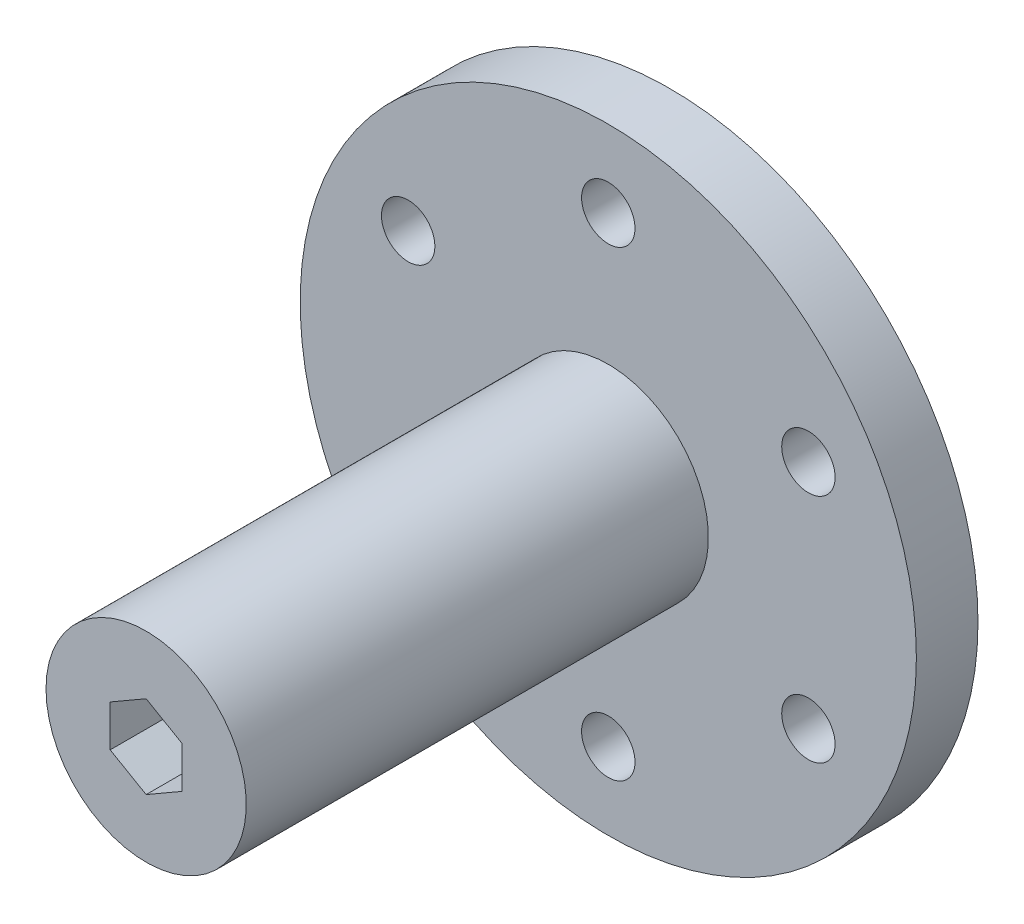
from build123d import *

# Parameters (mm, degrees)
SKETCH1_R           = 30
BOSS_EXTRUDE1_DEPTH = 6
SKETCH2_R           = 9.75
BOSS_EXTRUDE2_DEPTH = 45
CUT_EXTRUDE1_DEPTH  = 67.340033162
SKETCH5_R           = 2.6
CUT_EXTRUDE3_DEPTH  = 30


with BuildPart() as part:
    # Sketch1 → Boss-Extrude1 (new body)
    with BuildSketch(Plane.XY):
        Circle(SKETCH1_R)
    extrude(amount=BOSS_EXTRUDE1_DEPTH)

    # Sketch2 → Boss-Extrude2 (add)
    with BuildSketch(Plane.XY.offset(6)):
        with Locations(Location((0, 0, 0), (0, 0, 180))):
            Circle(SKETCH2_R)
    extrude(amount=BOSS_EXTRUDE2_DEPTH)

    # Sketch3 → Cut-Extrude1 (cut, through all)
    with BuildSketch(Plane.XY.offset(51)):
        Polygon((0, 4.041451884), (-3.5, 2.020725942), (-3.5, -2.020725942), (0, -4.041451884), (3.5, -2.020725942), (3.5, 2.020725942), align=None)
    extrude(amount=-CUT_EXTRUDE1_DEPTH, mode=Mode.SUBTRACT)

    # Sketch5 → Cut-Extrude3 (cut)
    with BuildSketch(Plane(origin=(0, 0, 0), x_dir=(-1, 0, 0), z_dir=(0, 0, -1))):
        with Locations((0, 22.5)):
            Circle(SKETCH5_R)
        with Locations((19.485571585, 11.25)):
            Circle(SKETCH5_R)
        with Locations((19.485571585, -11.25)):
            Circle(SKETCH5_R)
        with Locations((0, -22.5)):
            Circle(SKETCH5_R)
        with Locations((-19.485571585, -11.25)):
            Circle(SKETCH5_R)
        with Locations((-19.485571585, 11.25)):
            Circle(SKETCH5_R)
    extrude(amount=-CUT_EXTRUDE3_DEPTH, mode=Mode.SUBTRACT)


solid = part.part
